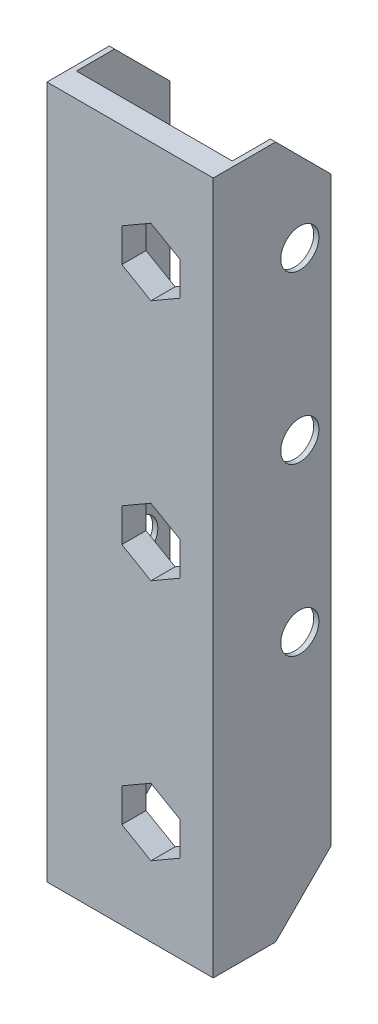
from build123d import *

# Parameters (mm, degrees)
BOSS_EXTRUDE1_DEPTH     = 100
CUT_EXTRUDE1_DEPTH      = 105.235310716
CUT_EXTRUDE1_DEPTH_BACK = 105.235310716
M5_CLEARANCE_HOLE1_D    = 5.5
CHAMFER1_SIZE           = 8


with BuildPart() as part:
    # Sketch1 → Boss-Extrude1 (new body)
    with BuildSketch(Plane(origin=(0, 0, 0), x_dir=(1, 0, 0), z_dir=(0, 1, 0))):
        Polygon((0, 0), (0, 17), (0.75, 17), (0.75, 3.5), (23.25, 3.5), (23.25, 17), (24, 17), (24, 0), align=None)
    extrude(amount=BOSS_EXTRUDE1_DEPTH)

    # Sketch2 → Cut-Extrude1 (cut, two sides: drawn at the far end of the back side and taken through both)
    with BuildSketch(Plane.XY.offset(-CUT_EXTRUDE1_DEPTH_BACK)):
        Polygon((10.8, 52.424871131), (10.8, 47.575128869), (15, 45.150257739), (19.2, 47.575128869), (19.2, 52.424871131), (15, 54.849742261), align=None)
        Polygon((19.2, 12.575128869), (19.2, 17.424871131), (15, 19.849742261), (10.8, 17.424871131), (10.8, 12.575128869), (15, 10.150257739), align=None)
        Polygon((10.8, 87.424871131), (10.8, 82.575128869), (15, 80.150257739), (19.2, 82.575128869), (19.2, 87.424871131), (15, 89.849742261), align=None)
    extrude(amount=CUT_EXTRUDE1_DEPTH + CUT_EXTRUDE1_DEPTH_BACK, mode=Mode.SUBTRACT)

    # M5 Clearance Hole1 (through all)
    with Locations(Plane(origin=(24, 0, 0), x_dir=(0, 0, -1), z_dir=(1, 0, 0))):
        with Locations((12.5, 85), (12.5, 37), (12.5, 61)):
            Hole(M5_CLEARANCE_HOLE1_D / 2)

    # Chamfer1
    chamfer1_edges = [part.edges().sort_by_distance(p)[0] for p in [
        (23.625, 0, -17),
        (23.625, 100, -17),
        (0.375, 100, -17),
        (0.375, 0, -17),
    ]]
    chamfer(chamfer1_edges, length=CHAMFER1_SIZE)


solid = part.part
